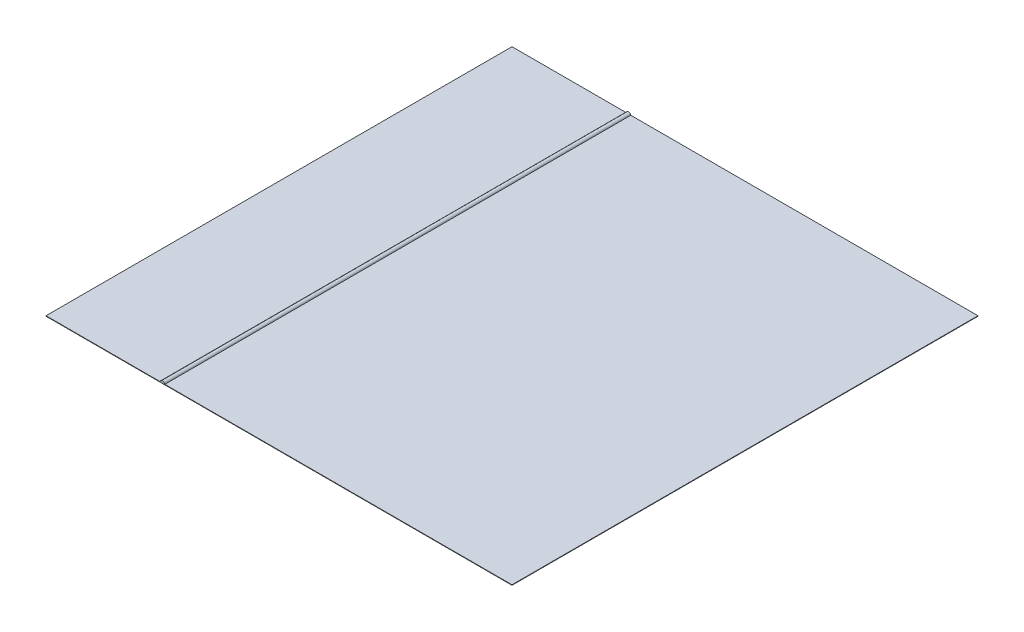
from build123d import *

# Parameters (mm, degrees)
SKETCH1_W           = 10000
SKETCH1_H           = 10000
BOSS_EXTRUDE1_DEPTH = 10
BOSS_EXTRUDE3_DEPTH = 10000


with BuildPart() as part:
    # Sketch1 → Boss-Extrude1 (new body)
    with BuildSketch(Plane(origin=(0, 0, 0), x_dir=(1, 0, 0), z_dir=(0, 1, 0))):
        Rectangle(SKETCH1_W, SKETCH1_H)
    extrude(amount=BOSS_EXTRUDE1_DEPTH)

    # Sketch4 → Boss-Extrude3 (add)
    with BuildSketch(Plane.XY.offset(5000)):
        with BuildLine():
            Line((-2451.010205144, 10), (-2548.989794856, 10))
            ThreePointArc((-2548.989794856, 10), (-2500, 50), (-2451.010205144, 10))
        make_face()
    extrude(amount=-BOSS_EXTRUDE3_DEPTH)


solid = part.part
